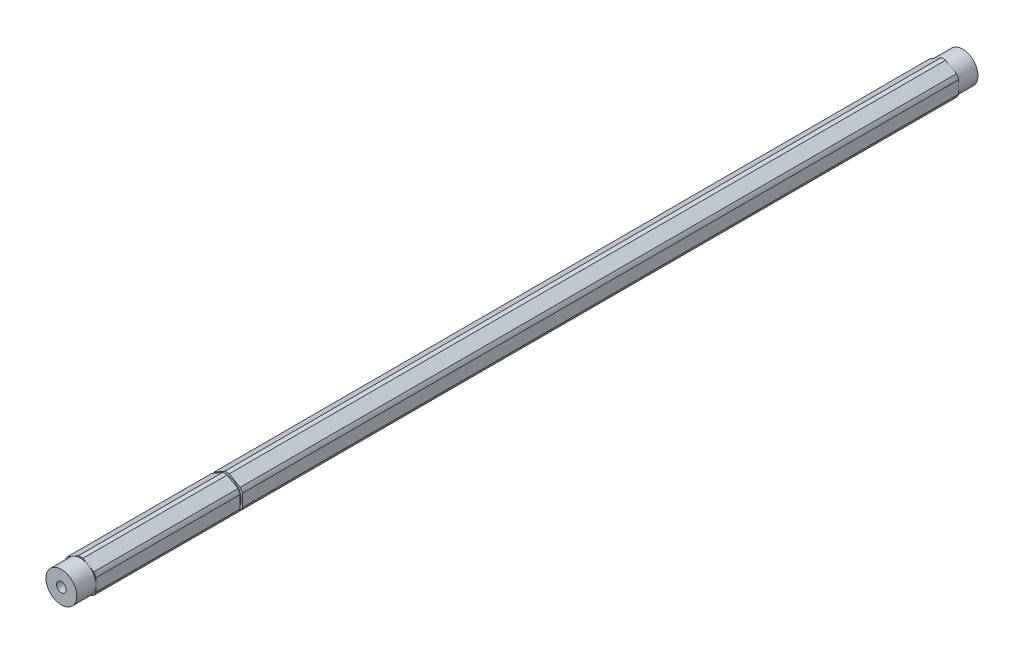
from build123d import *

# Parameters (mm, degrees)
SKETCH1_R           = 2.000000064
BOSS_EXTRUDE1_DEPTH = 177.8
SKETCH3_R           = 6.35
SKETCH3_R_2         = 2.000000064
BOSS_EXTRUDE3_DEPTH = 7.9375
SKETCH5_W           = 0.889
SKETCH5_H           = 1.0033


with BuildPart() as part:
    # Sketch1 → Boss-Extrude1 (new, symmetric)
    with BuildSketch(Plane.XY):
        with BuildLine():
            ThreePointArc((0.93173274, 6.79441227), (0, 6.858), (-0.93173274, 6.79441227))
            Line((-0.93173274, 6.79441227), (-5.41826726, 4.204110358))
            ThreePointArc((-5.41826726, 4.204110358), (-5.939202219, 3.429), (-6.35, 2.590301913))
            Line((-6.35, 2.590301913), (-6.35, -2.590301913))
            ThreePointArc((-6.35, -2.590301913), (-5.939202219, -3.429), (-5.41826726, -4.204110358))
            Line((-5.41826726, -4.204110358), (-0.93173274, -6.79441227))
            ThreePointArc((-0.93173274, -6.79441227), (0, -6.858), (0.93173274, -6.79441227))
            Line((0.93173274, -6.79441227), (5.41826726, -4.204110358))
            ThreePointArc((5.41826726, -4.204110358), (5.939202219, -3.429), (6.35, -2.590301913))
            Line((6.35, -2.590301913), (6.35, 2.590301913))
            ThreePointArc((6.35, 2.590301913), (5.939202219, 3.429), (5.41826726, 4.204110358))
            Line((5.41826726, 4.204110358), (0.93173274, 6.79441227))
        make_face()
        Circle(SKETCH1_R, mode=Mode.SUBTRACT)
    extrude(amount=BOSS_EXTRUDE1_DEPTH, both=True)

    # Sketch3 → Boss-Extrude3 (add)
    with BuildSketch(Plane.XY.offset(177.8)):
        Circle(SKETCH3_R)
        Circle(SKETCH3_R_2, mode=Mode.SUBTRACT)
    boss_extrude3 = extrude(amount=BOSS_EXTRUDE3_DEPTH)

    # Mirror1: Boss-Extrude3 across plane
    add(boss_extrude3.mirror(Plane.XY))

    # Sketch5 → Cut-Revolve1 (revolve, cut)
    with BuildSketch(Plane(origin=(0, 0, 0), x_dir=(0, 0, -1), z_dir=(1, 0, 0)), mode=Mode.PRIVATE) as cut_revolve1_sk:
        with Locations((-117.9195, 6.35635)):
            Rectangle(SKETCH5_W, SKETCH5_H)
    revolve(cut_revolve1_sk.sketch.rotate(Axis((0, 0, 0), (0, 0, -1)), 90), axis=Axis((0, 0, 0), (0, 0, -1)), mode=Mode.SUBTRACT)


solid = part.part
